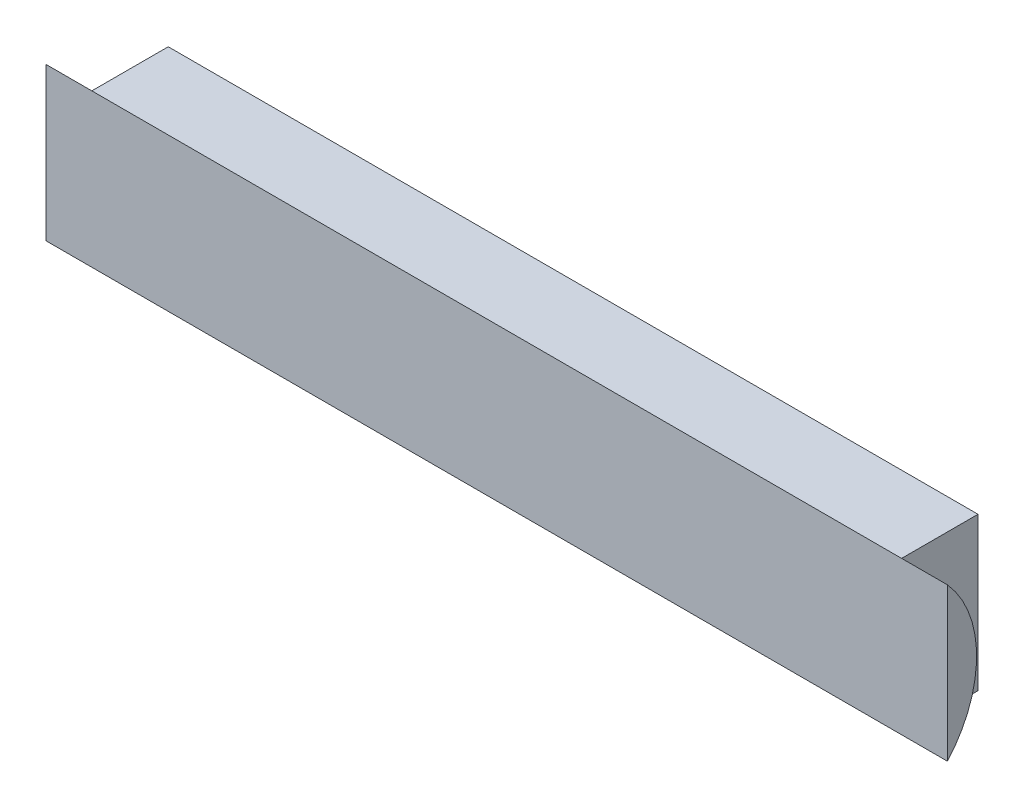
from build123d import *

# Parameters (mm, degrees)
SKETCH_1_W      = 53
SKETCH_1_H      = 10
EXTRUDE_1_DEPTH = 5
EXTRUDE_2_DEPTH = 3
EXTRUDE_START   = 3
EXTRUDE_3_DEPTH = 3


with BuildPart() as part:
    # 草图1 → 凸台-拉伸1 (new body)
    with BuildSketch(Plane.XY):
        Rectangle(SKETCH_1_W, SKETCH_1_H)
    extrude(amount=EXTRUDE_1_DEPTH)

    # 草图2 → 凸台-拉伸2 (add)
    with BuildSketch(Plane(origin=(26.5, 0, 0), x_dir=(0, 0, -1), z_dir=(1, 0, 0))):
        with BuildLine():
            Line((-5, 5), (-5, -5))
            ThreePointArc((-5, -5), (-3.090169944, 0), (-5, 5))
        make_face()
    extrude(amount=EXTRUDE_2_DEPTH)

    # 草图3 → 凸台-拉伸3 (add)
    with BuildSketch(Plane.ZY.offset(26.5).offset(EXTRUDE_START)):
        with BuildLine():
            Line((5, -5), (5, 5))
            ThreePointArc((5, 5), (3.090169944, 0), (5, -5))
        make_face()
    extrude(amount=-EXTRUDE_3_DEPTH)


solid = part.part
